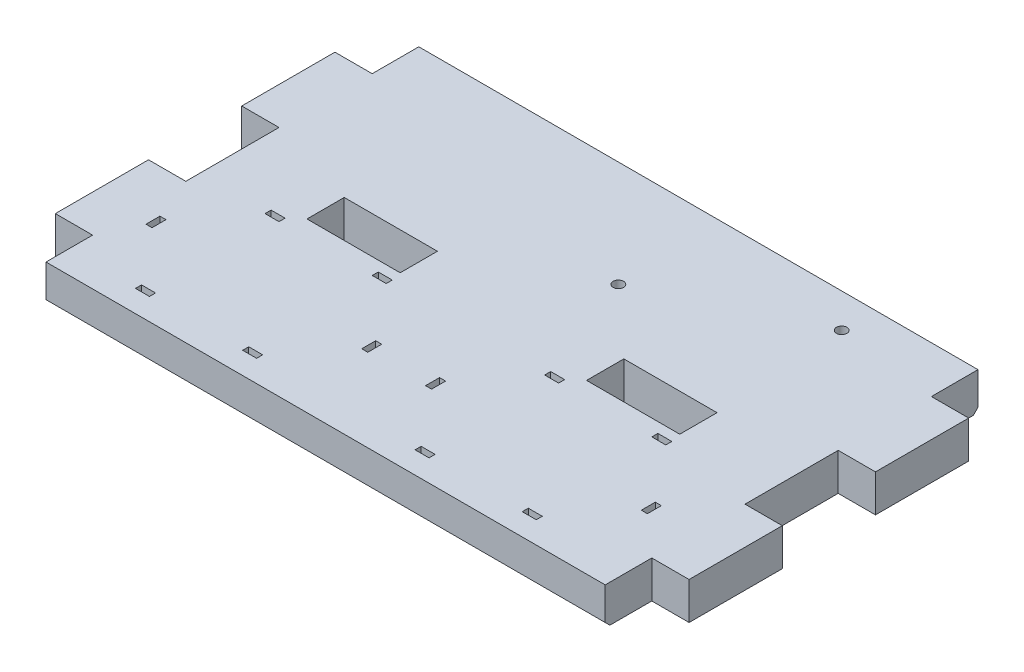
from build123d import *

# Parameters (mm, degrees)
SKETCH1_W           = 120
SKETCH1_H           = 80
SKETCH1_R           = 1.13
SKETCH1_W_2         = 3
SKETCH1_H_2         = 1.3
SKETCH1_W_3         = 1.3
SKETCH1_H_3         = 3
BOSS_EXTRUDE1_DEPTH = 8
CUT_EXTRUDE1_DEPTH  = 4
CHAMFER1_SIZE       = 1
CUT_EXTRUDE2_REACH  = 74.553
SKETCH3_W           = 20
SKETCH3_H           = 8
SKETCH4_W           = 20
SKETCH4_H           = 8
BOSS_EXTRUDE2_DEPTH = 8


with BuildPart() as part:
    # Sketch1 → Boss-Extrude1 (new body)
    with BuildSketch(Plane(origin=(0, 0, 0), x_dir=(1, 0, 0), z_dir=(0, 1, 0))):
        Rectangle(SKETCH1_W, SKETCH1_H)
        with Locations(Location((38.07, 32.68, 0), (0, 0, 270))):
            Circle(SKETCH1_R, mode=Mode.SUBTRACT)
        with Locations(Location((5.56, 17.26, 0), (0, 0, 270))):
            Circle(SKETCH1_R, mode=Mode.SUBTRACT)
        with Locations((16, -34.65)):
            Rectangle(SKETCH1_W_2, SKETCH1_H_2, mode=Mode.SUBTRACT)
        with Locations((16, -6.85)):
            Rectangle(SKETCH1_W_2, SKETCH1_H_2, mode=Mode.SUBTRACT)
        with Locations((39, -6.85)):
            Rectangle(SKETCH1_W_2, SKETCH1_H_2, mode=Mode.SUBTRACT)
        with Locations((39, -34.65)):
            Rectangle(SKETCH1_W_2, SKETCH1_H_2, mode=Mode.SUBTRACT)
        with Locations((50.65, -20.75)):
            Rectangle(SKETCH1_W_3, SKETCH1_H_3, mode=Mode.SUBTRACT)
        with Locations((4.35, -20.75)):
            Rectangle(SKETCH1_W_3, SKETCH1_H_3, mode=Mode.SUBTRACT)
        with Locations((-55.65, -20.75)):
            Rectangle(SKETCH1_W_3, SKETCH1_H_3, mode=Mode.SUBTRACT)
        with Locations((-9.35, -20.75)):
            Rectangle(SKETCH1_W_3, SKETCH1_H_3, mode=Mode.SUBTRACT)
        with Locations((-44, -34.65)):
            Rectangle(SKETCH1_W_2, SKETCH1_H_2, mode=Mode.SUBTRACT)
        with Locations((-44, -6.85)):
            Rectangle(SKETCH1_W_2, SKETCH1_H_2, mode=Mode.SUBTRACT)
        with Locations((-21, -34.65)):
            Rectangle(SKETCH1_W_2, SKETCH1_H_2, mode=Mode.SUBTRACT)
        with Locations((-21, -6.85)):
            Rectangle(SKETCH1_W_2, SKETCH1_H_2, mode=Mode.SUBTRACT)
    extrude(amount=BOSS_EXTRUDE1_DEPTH)

    # Sketch2 → Cut-Extrude1 (cut)
    with BuildSketch(Plane.XZ):
        Polygon((7.869401077, -17.26), (6.714700538, -15.26), (4.405299462, -15.26), (3.250598923, -17.26), (4.405299462, -19.26), (6.714700538, -19.26), align=None)
        Polygon((40.379401077, -32.68), (39.224700538, -30.68), (36.915299462, -30.68), (35.760598923, -32.68), (36.915299462, -34.68), (39.224700538, -34.68), align=None)
    extrude(amount=-CUT_EXTRUDE1_DEPTH, mode=Mode.SUBTRACT)

    # Chamfer1
    chamfer1_edges = [part.edges().sort_by_distance(p)[0] for p in [
        (0, 0, -40),
        (0, 0, 40),
    ]]
    chamfer(chamfer1_edges, length=CHAMFER1_SIZE)

    # Sketch3 → Cut-Extrude2 (cut, up to next)
    with BuildSketch(Plane.XZ, mode=Mode.PRIVATE) as cut_extrude2_sk1:
        with Locations((-30, 0)):
            Rectangle(SKETCH3_W, SKETCH3_H)
    cut_extrude2_tool1 = extrude(cut_extrude2_sk1.sketch, amount=-CUT_EXTRUDE2_REACH, mode=Mode.PRIVATE) & part.part
    cut_extrude2 = cut_extrude2_tool1.solids().sort_by_distance((-30, 0, 0))[0]
    add(cut_extrude2, mode=Mode.SUBTRACT)

    # Mirror1: Cut-Extrude2 across plane
    add(cut_extrude2.mirror(Plane.ZY), mode=Mode.SUBTRACT)

    # Sketch4 → Boss-Extrude2 (add)
    with BuildSketch(Plane.ZY.offset(60)):
        with Locations((20, 4)):
            Rectangle(SKETCH4_W, SKETCH4_H)
        with Locations((-20, 4)):
            Rectangle(SKETCH4_W, SKETCH4_H)
    boss_extrude2 = extrude(amount=BOSS_EXTRUDE2_DEPTH)

    # Mirror2: Boss-Extrude2 across plane
    add(boss_extrude2.mirror(Plane.ZY))


solid = part.part
